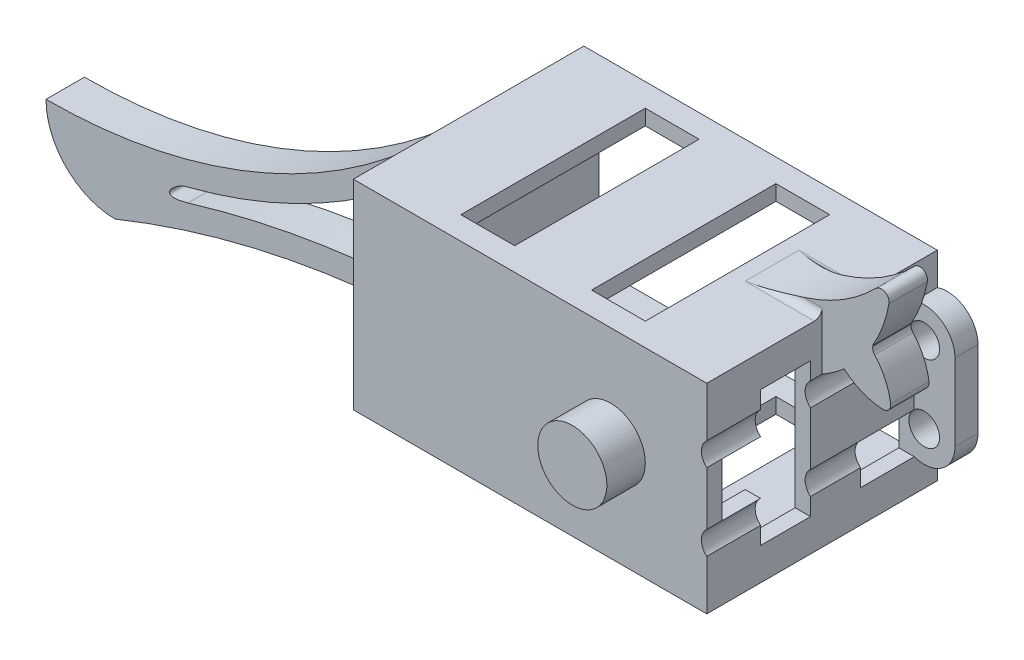
from build123d import *
from build123d.topology import SkipClean

# Parameters (mm, degrees)
SKETCH1_W            = 46
SKETCH1_H            = 26
BOSS_EXTRUDE3_DEPTH  = 30
SHELL1_T             = -2
SKETCH4_R            = 2
CUT_EXTRUDE2_DEPTH   = 40.974992183
BOSS_EXTRUDE4_START  = -3
BOSS_EXTRUDE4_DEPTH  = 3
SKETCH5_W            = 7
SKETCH5_H            = 2.262987649
SKETCH5_H_2          = 3.03973683
SKETCH5_H_3          = 5.302724479
SKETCH5_W_2          = 6.5
SKETCH5_W_3          = 5
SKETCH5_H_4          = 6.96026317
CUT_EXTRUDE4_DEPTH   = 61.833296804
SKETCH6_W            = 7
SKETCH6_H            = 24
CUT_EXTRUDE6_DEPTH   = 49.753358859
SKETCH7_W            = 6.5
SKETCH7_H            = 2.262987649
SKETCH7_W_2          = 7
SKETCH7_H_2          = 15.302724479
BOSS_EXTRUDE13_DEPTH = 2
BOSS_EXTRUDE16_DEPTH = 5
BOSS_EXTRUDE18_START = -15
BOSS_EXTRUDE18_DEPTH = 5
FILLET1_R            = 1
FILLET2_R            = 1
FILLET3_R            = 1
FILLET4_R            = 1
SKETCH17_R           = 100.847995084
CUT_EXTRUDE7_DEPTH   = 89.277970185


with BuildPart() as part:
    # Sketch1 → Boss-Extrude3 (new body)
    with BuildSketch(Plane.XY):
        Rectangle(SKETCH1_W, SKETCH1_H)
    extrude(amount=BOSS_EXTRUDE3_DEPTH)

    # Shell1
    shell1_openings = [part.faces().sort_by_distance(p)[0] for p in [
        (0, 0, 30),
    ]]
    offset(amount=SHELL1_T, openings=shell1_openings, kind=Kind.INTERSECTION)

    # Sketch4 → Cut-Extrude2 (cut, through all)
    with BuildSketch(Plane.XY):
        with Locations((24.3, 5)):
            Circle(SKETCH4_R)
        with Locations((24.3, -5)):
            Circle(SKETCH4_R)
        with Locations((-24.3, 5)):
            Circle(SKETCH4_R)
        with Locations((-24.3, -5)):
            Circle(SKETCH4_R)
    extrude(amount=CUT_EXTRUDE2_DEPTH, mode=Mode.SUBTRACT)

    # Sketch2 → Boss-Extrude4 (add)
    with BuildSketch(Plane.XY.offset(30).offset(BOSS_EXTRUDE4_START)):
        with BuildLine():
            ThreePointArc((-23, 8.782856064), (-26.623790008, 8.255764119), (-28.3, 5))
            Line((-28.3, 5), (-28.3, -5))
            ThreePointArc((-28.3, -5), (-26.623790008, -8.255764119), (-23, -8.782856064))
            Line((-23, -8.782856064), (-23, -6.519868415))
            ThreePointArc((-23, -6.519868415), (-26.3, -5), (-23, -3.480131585))
            Line((-23, -3.480131585), (-23, 3.480131585))
            ThreePointArc((-23, 3.480131585), (-26.3, 5), (-23, 6.519868415))
            Line((-23, 6.519868415), (-23, 8.782856064))
        make_face()
        with BuildLine():
            ThreePointArc((28.3, 5), (26.623790008, 8.255764119), (23, 8.782856064))
            Line((23, 8.782856064), (23, 6.519868415))
            ThreePointArc((23, 6.519868415), (26.3, 5), (23, 3.480131585))
            Line((23, 3.480131585), (23, -3.480131585))
            ThreePointArc((23, -3.480131585), (26.3, -5), (23, -6.519868415))
            Line((23, -6.519868415), (23, -8.782856064))
            ThreePointArc((23, -8.782856064), (26.623790008, -8.255764119), (28.3, -5))
            Line((28.3, -5), (28.3, 5))
        make_face()
    extrude(amount=BOSS_EXTRUDE4_DEPTH)

    # Sketch5 → Cut-Extrude4 (cut, through all)
    with BuildSketch(Plane(origin=(23, 0, 0), x_dir=(0, 0, -1), z_dir=(1, 0, 0))):
        with Locations((-23.5, 7.65136224)):
            Rectangle(SKETCH5_W, SKETCH5_H)
        with Locations((-23.5, 5)):
            Rectangle(SKETCH5_W, SKETCH5_H_2)
        with Locations((-23.5, -6.131493825)):
            Rectangle(SKETCH5_W, SKETCH5_H_3)
        with Locations((-10.25, 7.65136224)):
            Rectangle(SKETCH5_W_2, SKETCH5_H)
        Polygon((-7, 6.519868415), (-13.5, 6.519868415), (-13.5, -8.782856064), (-7, -8.782856064), (-7, -3.480131585), (-7, 3.480131585), align=None)
        with Locations((-4.5, 0)):
            Rectangle(SKETCH5_W_3, SKETCH5_H_4)
    extrude(amount=-CUT_EXTRUDE4_DEPTH, mode=Mode.SUBTRACT)

    # Sketch6 → Cut-Extrude6 (cut, through all)
    with BuildSketch(Plane(origin=(0, 13, 0), x_dir=(1, 0, 0), z_dir=(0, 1, 0))):
        with Locations((8.5, -15)):
            Rectangle(SKETCH6_W, SKETCH6_H)
        with Locations((-8.5, -15)):
            Rectangle(SKETCH6_W, SKETCH6_H)
    extrude(amount=-CUT_EXTRUDE6_DEPTH, mode=Mode.SUBTRACT)

    # Sketch7 → Boss-Extrude13 (add)
    with BuildSketch(Plane.ZY.offset(23)):
        with Locations((16.75, 7.65136224)):
            Rectangle(SKETCH7_W, SKETCH7_H)
        with Locations((10.25, 7.65136224)):
            Rectangle(SKETCH7_W, SKETCH7_H)
        Polygon((7, -8.782856064), (20, -8.782856064), (20, 6.519868415), (13.5, 6.519868415), (7, 6.519868415), align=None)
        with Locations((3.5, -1.131493825)):
            Rectangle(SKETCH7_W_2, SKETCH7_H_2)
    extrude(amount=-BOSS_EXTRUDE13_DEPTH)

    # Sketch9 → Boss-Extrude16 (add)
    with BuildSketch(Plane.XY):
        with BuildLine():
            ThreePointArc((15, 0), (13.681980515, 3.181980515), (10.5, 4.5))
            Line((10.5, 4.5), (10.5, -4.5))
            ThreePointArc((10.5, -4.5), (13.681980515, -3.181980515), (15, 0))
        make_face()
        with BuildLine():
            Line((10.5, -4.5), (10.5, 4.5))
            ThreePointArc((10.5, 4.5), (6, 0), (10.5, -4.5))
        make_face()
    extrude(amount=-BOSS_EXTRUDE16_DEPTH)

    # Sketch14 → Boss-Extrude18 (add)
    with BuildSketch(Plane(origin=(0, 0, 0), x_dir=(-1, 0, 0), z_dir=(0, 0, -1)).offset(BOSS_EXTRUDE18_START)):
        with BuildLine():
            ThreePointArc((78, -13), (47.582077651, -6.172528045), (23, 13))
            Line((23, 13), (23, 8.407171524))
            ThreePointArc((23, 8.407171524), (39.649221668, -5.316001993), (59.543496906, -13.667043022))
            add(Edge.make_bspline(
                [(59.543496906, -13.667043022), (61.159670989, -13.928651664), (63.956682001, -16.675845131), (59.543496906, -15.458461907)],
                knots=[0.928317086, 0.928317086, 0.928317086, 0.928317086, 1.928317086, 1.928317086, 1.928317086, 1.928317086], degree=3))
            ThreePointArc((59.543496906, -15.458461907), (41.474455151, -11.372143239), (23, -10))
            Line((23, -10), (23, -13))
            ThreePointArc((23, -13), (46.436083291, -15.271129848), (69, -22))
            ThreePointArc((69, -22), (75.363961031, -19.363961031), (78, -13))
        make_face()
        with BuildLine():
            ThreePointArc((-14, 13), (-22.68093218, 14.742075815), (-30.017611738, 19.698540757))
            ThreePointArc((-30.017611738, 19.698540757), (-31.190497509, 19.883658013), (-31.71341721, 18.817597781))
            ThreePointArc((-31.71341721, 18.817597781), (-30.891492904, 15.814295174), (-29.559153314, 13))
            Line((-29.559153314, 13), (-29.615016918, 13))
            ThreePointArc((-29.615016918, 13), (-29.627736578, 12.534342429), (-29.850028113, 12.12497067))
            ThreePointArc((-29.850028113, 12.12497067), (-31.224443045, 10.041092369), (-31.924156987, 7.644852487))
            ThreePointArc((-31.924156987, 7.644852487), (-31.729252992, 6.90539385), (-31.068831324, 6.519868415))
            Line((-31.068831324, 6.519868415), (-30.762800771, 6.519868415))
            ThreePointArc((-30.762800771, 6.519868415), (-28.154195214, 7.143228754), (-25.876056336, 8.558673673))
            ThreePointArc((-25.876056336, 8.558673673), (-24.48859005, 7.467945536), (-23, 6.519868415))
            Line((-23, 6.519868415), (-23, 13))
            Line((-23, 13), (-14, 13))
        make_face()
    extrude(amount=-BOSS_EXTRUDE18_DEPTH)

    # Fillet1
    fillet1_edges = [part.edges().sort_by_distance(p)[0] for p in [
        (-23, 8.407171524, 17.5),
    ]]
    fillet(fillet1_edges, radius=FILLET1_R)

    # Fillet2
    fillet2_edges = [part.edges().sort_by_distance(p)[0] for p in [
        (-23, -10, 17.5),
    ]]
    fillet(fillet2_edges, radius=FILLET2_R)

    # Fillet3
    fillet3_edges = [part.edges().sort_by_distance(p)[0] for p in [
        (18.5, 13, 15),
    ]]
    fillet(fillet3_edges, radius=FILLET3_R)

    # Fillet4
    fillet4_edges = [part.edges().sort_by_distance(p)[0] for p in [
        (18.5, 13, 20),
    ]]
    fillet(fillet4_edges, radius=FILLET4_R)

    # Mirror1: part across plane


with BuildPart() as part_1:
    add(part.part)
    add(part.part.mirror(Plane(origin=(0, 0, 30), x_dir=(1, 0, 0), z_dir=(0, 0, -1))))

    # Sketch17 → Cut-Extrude7 (cut, through all)
    with SkipClean():  # the faces are left unmerged after this step: merging them gives an invalid solid
        with BuildSketch(Plane(origin=(0, 0, 30), x_dir=(-1, 0, 0), z_dir=(0, 0, -1))):
            Circle(SKETCH17_R)
        extrude(amount=CUT_EXTRUDE7_DEPTH, mode=Mode.SUBTRACT)


solid = part_1.part
